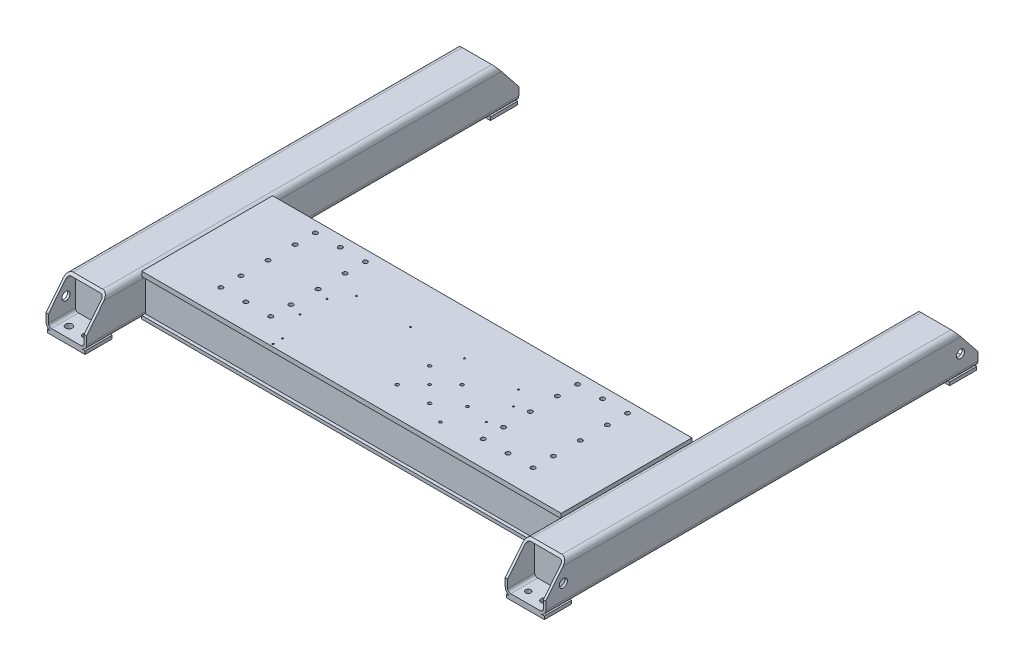
from build123d import *

# Parameters (mm, degrees)
EXTRUDE_1_DEPTH          = 800
EXTRUDE_1_DEPTH_BACK     = 800
EXTRUDE_1_2_DEPTH        = 800
EXTRUDE_1_2_DEPTH_BACK   = 800
CUT_EXTRUDE_1_DEPTH      = 1234.640547323
CUT_EXTRUDE_1_DEPTH_BACK = 1234.640547323
EXTRUDE_2_DEPTH          = 775
EXTRUDE_2_DEPTH_BACK     = 775
SKETCH_3_W               = 12
SKETCH_3_H               = 125
EXTRUDE_3_DEPTH          = 6
EXTRUDE_3_DEPTH_BACK     = 6
SKETCH_4_W               = 436
SKETCH_4_H               = 125
EXTRUDE_5_DEPTH          = 776.64969722
EXTRUDE_5_DEPTH_BACK     = 776.64969722
SKETCH_6_W               = 484
SKETCH_6_H               = 12
EXTRUDE_6_DEPTH          = 776.245006005
EXTRUDE_6_DEPTH_BACK     = 776.245006005
SKETCH_7_W               = 484
SKETCH_7_H               = 17
SKETCH_8_W               = 140
SKETCH_8_H               = 100
EXTRUDE_7_DEPTH          = 12
SKETCH_11_W              = 133
SKETCH_11_H              = 133
EXTRUDE_8_DEPTH          = 9
SKETCH_12_W              = 133
SKETCH_12_H              = 133
EXTRUDE_9_DEPTH          = 9
CUT_EXTRUDE_2_DEPTH      = 1235.1721922
CUT_EXTRUDE_2_DEPTH_BACK = 1235.1721922
CUT_EXTRUDE_3_DEPTH      = 1235.1721922
CUT_EXTRUDE_3_DEPTH_BACK = 1235.1721922
SKETCH_16_R              = 8
CUT_EXTRUDE_4_DEPTH      = 17
SKETCH_17_R              = 8
CUT_EXTRUDE_5_DEPTH      = 17
SKETCH_18_R              = 3
CUT_EXTRUDE_6_DEPTH      = 12
SKETCH_19_R              = 3
CUT_EXTRUDE_7_DEPTH      = 17
SKETCH_20_R              = 3
CUT_EXTRUDE_8_DEPTH      = 17
SKETCH_21_R              = 6
CUT_EXTRUDE_9_DEPTH      = 17
SKETCH_22_R              = 5
CUT_EXTRUDE_10_DEPTH     = 17
SKETCH_23_R              = 5
CUT_EXTRUDE_11_DEPTH     = 17
SKETCH_25_R              = 12.5
CUT_EXTRUDE_13_DEPTH     = 21
SKETCH_27_R              = 10
CUT_EXTRUDE_15_DEPTH     = 21
SKETCH_30_R              = 15
CUT_EXTRUDE_17_DEPTH     = 9
CUT_EXTRUDE_START        = -9
SKETCH_32_R              = 15
CUT_EXTRUDE_18_DEPTH     = 9


with BuildPart() as part:
    # ｽｹｯﾁ1 → ﾎﾞｽ - 押し出し1 (new, two sides: drawn at the far end of the back side and taken through both)
    with BuildSketch(Plane.XY.offset(-EXTRUDE_1_DEPTH_BACK)):
        with BuildLine():
            Line((-905, 12), (-795, 12))
            ThreePointArc((-795, 12), (-780.857864376, 17.857864376), (-775, 32))
            Line((-775, 32), (-775, 142))
            ThreePointArc((-775, 142), (-780.857864376, 156.142135624), (-795, 162))
            Line((-795, 162), (-905, 162))
            ThreePointArc((-905, 162), (-919.142135624, 156.142135624), (-925, 142))
            Line((-925, 142), (-925, 32))
            ThreePointArc((-925, 32), (-919.142135624, 17.857864376), (-905, 12))
        make_face()
    extrude(amount=EXTRUDE_1_DEPTH + EXTRUDE_1_DEPTH_BACK)


with BuildPart() as body_2:
    # ｽｹｯﾁ1 → Extrude 1 2 (new, two sides: drawn at the far end of the back side and taken through both)
    with BuildSketch(Plane.XY.offset(-EXTRUDE_1_2_DEPTH_BACK)):
        with BuildLine():
            Line((795, 12), (905, 12))
            ThreePointArc((905, 12), (919.142135624, 17.857864376), (925, 32))
            Line((925, 32), (925, 142))
            ThreePointArc((925, 142), (919.142135624, 156.142135624), (905, 162))
            Line((905, 162), (795, 162))
            ThreePointArc((795, 162), (780.857864376, 156.142135624), (775, 142))
            Line((775, 142), (775, 32))
            ThreePointArc((775, 32), (780.857864376, 17.857864376), (795, 12))
        make_face()
    extrude(amount=EXTRUDE_1_2_DEPTH + EXTRUDE_1_2_DEPTH_BACK)


with BuildPart() as cut_extrude_1_tool:
    # ｽｹｯﾁ2 → ｶｯﾄ - 押し出し1 (new, two sides: drawn at the far end of the back side and taken through both)
    with BuildSketch(Plane.XY.offset(-CUT_EXTRUDE_1_DEPTH_BACK)):
        with BuildLine():
            Line((-905, 21), (-795, 21))
            ThreePointArc((-795, 21), (-787.221825407, 24.221825407), (-784, 32))
            Line((-784, 32), (-784, 142))
            ThreePointArc((-784, 142), (-787.221825407, 149.778174593), (-795, 153))
            Line((-795, 153), (-905, 153))
            ThreePointArc((-905, 153), (-912.778174593, 149.778174593), (-916, 142))
            Line((-916, 142), (-916, 32))
            ThreePointArc((-916, 32), (-912.778174593, 24.221825407), (-905, 21))
        make_face()
        with BuildLine():
            Line((795, 21), (905, 21))
            ThreePointArc((905, 21), (912.778174593, 24.221825407), (916, 32))
            Line((916, 32), (916, 142))
            ThreePointArc((916, 142), (912.778174593, 149.778174593), (905, 153))
            Line((905, 153), (795, 153))
            ThreePointArc((795, 153), (787.221825407, 149.778174593), (784, 142))
            Line((784, 142), (784, 32))
            ThreePointArc((784, 32), (787.221825407, 24.221825407), (795, 21))
        make_face()
    extrude(amount=CUT_EXTRUDE_1_DEPTH + CUT_EXTRUDE_1_DEPTH_BACK)


with BuildPart() as part_1:
    add(part.part)

    # ｶｯﾄ - 押し出し1: cut by cut_extrude_1_tool
    add(cut_extrude_1_tool.part, mode=Mode.SUBTRACT)



with BuildPart() as body_2_1:
    add(body_2.part)

    # ｶｯﾄ - 押し出し1: cut by cut_extrude_1_tool
    add(cut_extrude_1_tool.part, mode=Mode.SUBTRACT)


with BuildPart() as part_2:
    add(part_1.part)

    add(body_2_1.part)  # ﾎﾞｽ - 押し出し2 merges body 2
    # ｽｹｯﾁ3 → ﾎﾞｽ - 押し出し2 (add, two sides: drawn at the far end of the back side and taken through both)
    with BuildSketch(Plane(origin=(0, 0, 0), x_dir=(0, 0, -1), z_dir=(1, 0, 0)).offset(-EXTRUDE_2_DEPTH_BACK)):
        with Locations((-576, 86.5)):
            Rectangle(SKETCH_3_W, SKETCH_3_H)
        with Locations((-128, 86.5)):
            Rectangle(SKETCH_3_W, SKETCH_3_H)
    extrude(amount=EXTRUDE_2_DEPTH + EXTRUDE_2_DEPTH_BACK)

    # ｽｹｯﾁ4 → ﾎﾞｽ - 押し出し3 (add, two sides: drawn at the far end of the back side and taken through both)
    with BuildSketch(Plane(origin=(0, 0, 0), x_dir=(0, 0, -1), z_dir=(1, 0, 0)).offset(-EXTRUDE_3_DEPTH_BACK)):
        with Locations((-352, 86.5)):
            Rectangle(SKETCH_4_W, SKETCH_4_H)
    extrude(amount=EXTRUDE_3_DEPTH + EXTRUDE_3_DEPTH_BACK)

    # ｽｹｯﾁ6 → ﾎﾞｽ - 押し出し5 (add, two sides: drawn at the far end of the back side and taken through both)
    with BuildSketch(Plane(origin=(0, 0, 0), x_dir=(0, 0, -1), z_dir=(1, 0, 0)).offset(-EXTRUDE_5_DEPTH_BACK)):
        with Locations((-352, 18)):
            Rectangle(SKETCH_6_W, SKETCH_6_H)
    extrude(amount=EXTRUDE_5_DEPTH + EXTRUDE_5_DEPTH_BACK)

    # ｽｹｯﾁ7 → ﾎﾞｽ - 押し出し6 (add, two sides: drawn at the far end of the back side and taken through both)
    with BuildSketch(Plane(origin=(0, 0, 0), x_dir=(0, 0, -1), z_dir=(1, 0, 0)).offset(-EXTRUDE_6_DEPTH_BACK)):
        with Locations((-352, 157.5)):
            Rectangle(SKETCH_7_W, SKETCH_7_H)
    extrude(amount=EXTRUDE_6_DEPTH + EXTRUDE_6_DEPTH_BACK)

    # ｽｹｯﾁ8 → ﾎﾞｽ - 押し出し7 (add)
    with BuildSketch(Plane(origin=(0, 0, 0), x_dir=(1, 0, 0), z_dir=(0, 1, 0))):
        with Locations((-850, -750)):
            Rectangle(SKETCH_8_W, SKETCH_8_H)
        with Locations((-850, 750)):
            Rectangle(SKETCH_8_W, SKETCH_8_H)
        with Locations((850, -750)):
            Rectangle(SKETCH_8_W, SKETCH_8_H)
        with Locations((850, 750)):
            Rectangle(SKETCH_8_W, SKETCH_8_H)
    extrude(amount=EXTRUDE_7_DEPTH)

    # ｽｹｯﾁ11 → ﾎﾞｽ - 押し出し8 (add)
    with BuildSketch(Plane.XY.offset(700)):
        with Locations((-850, 87)):
            Rectangle(SKETCH_11_W, SKETCH_11_H)
        with Locations((850, 87)):
            Rectangle(SKETCH_11_W, SKETCH_11_H)
    extrude(amount=-EXTRUDE_8_DEPTH)

    # ｽｹｯﾁ12 → ﾎﾞｽ - 押し出し9 (add)
    with BuildSketch(Plane.XY.offset(-700)):
        with Locations((-850, 87)):
            Rectangle(SKETCH_12_W, SKETCH_12_H)
        with Locations((850, 87)):
            Rectangle(SKETCH_12_W, SKETCH_12_H)
    extrude(amount=EXTRUDE_9_DEPTH)

    # ｽｹｯﾁ13 → ｶｯﾄ - 押し出し2 (cut, two sides: drawn at the far end of the back side and taken through both)
    with BuildSketch(Plane(origin=(0, 0, 0), x_dir=(0, 0, -1), z_dir=(1, 0, 0)).offset(-CUT_EXTRUDE_2_DEPTH_BACK)):
        Polygon((-850, -0.5), (-700, 187), (-700, 260), (-850, 260), align=None)
    extrude(amount=CUT_EXTRUDE_2_DEPTH + CUT_EXTRUDE_2_DEPTH_BACK, mode=Mode.SUBTRACT)

    # ｽｹｯﾁ14 → ｶｯﾄ - 押し出し3 (cut, two sides: drawn at the far end of the back side and taken through both)
    with BuildSketch(Plane(origin=(0, 0, 0), x_dir=(0, 0, -1), z_dir=(1, 0, 0)).offset(-CUT_EXTRUDE_3_DEPTH_BACK)):
        Polygon((850, -0.5), (700, 187), (700, 260), (850, 260), align=None)
    extrude(amount=CUT_EXTRUDE_3_DEPTH + CUT_EXTRUDE_3_DEPTH_BACK, mode=Mode.SUBTRACT)

    # ｽｹｯﾁ16 → ｶｯﾄ - 押し出し4 (cut)
    with BuildSketch(Plane(origin=(0, 166, 0), x_dir=(1, 0, 0), z_dir=(0, 1, 0))):
        with Locations((-578, -500)):
            Circle(SKETCH_16_R)
        with Locations((-485.5, -500)):
            Circle(SKETCH_16_R)
        with Locations((-393, -500)):
            Circle(SKETCH_16_R)
        with Locations((393, -500)):
            Circle(SKETCH_16_R)
        with Locations((485.5, -500)):
            Circle(SKETCH_16_R)
        with Locations((578, -500)):
            Circle(SKETCH_16_R)
        with Locations((-578, -425)):
            Circle(SKETCH_16_R)
        with Locations((-393, -425)):
            Circle(SKETCH_16_R)
        with Locations((393, -425)):
            Circle(SKETCH_16_R)
        with Locations((578, -425)):
            Circle(SKETCH_16_R)
        with Locations((-578, -225)):
            Circle(SKETCH_16_R)
        with Locations((-393, -225)):
            Circle(SKETCH_16_R)
        with Locations((393, -225)):
            Circle(SKETCH_16_R)
        with Locations((578, -225)):
            Circle(SKETCH_16_R)
        with Locations((-578, -150)):
            Circle(SKETCH_16_R)
        with Locations((-485.5, -150)):
            Circle(SKETCH_16_R)
        with Locations((-393, -150)):
            Circle(SKETCH_16_R)
        with Locations((393, -150)):
            Circle(SKETCH_16_R)
        with Locations((485.5, -150)):
            Circle(SKETCH_16_R)
        with Locations((578, -150)):
            Circle(SKETCH_16_R)
    extrude(amount=-CUT_EXTRUDE_4_DEPTH, mode=Mode.SUBTRACT)

    # ｽｹｯﾁ17 → ｶｯﾄ - 押し出し5 (cut)
    with BuildSketch(Plane(origin=(0, 166, 0), x_dir=(1, 0, 0), z_dir=(0, 1, 0))):
        with Locations((-578, -325)):
            Circle(SKETCH_17_R)
        with Locations((-393, -325)):
            Circle(SKETCH_17_R)
        with Locations((393, -325)):
            Circle(SKETCH_17_R)
        with Locations((578, -325)):
            Circle(SKETCH_17_R)
    extrude(amount=-CUT_EXTRUDE_5_DEPTH, mode=Mode.SUBTRACT)

    # ｽｹｯﾁ18 → ｶｯﾄ - 押し出し6 (cut)
    with BuildSketch(Plane(origin=(0, 166, 0), x_dir=(1, 0, 0), z_dir=(0, 1, 0))):
        with Locations((-300, -276)):
            Circle(SKETCH_18_R)
        with Locations((-100, -276)):
            Circle(SKETCH_18_R)
        with Locations((100, -276)):
            Circle(SKETCH_18_R)
        with Locations((300, -276)):
            Circle(SKETCH_18_R)
    extrude(amount=-CUT_EXTRUDE_6_DEPTH, mode=Mode.SUBTRACT)

    # ｽｹｯﾁ19 → ｶｯﾄ - 押し出し7 (cut)
    with BuildSketch(Plane(origin=(0, 166, 0), x_dir=(1, 0, 0), z_dir=(0, 1, 0))):
        with Locations((-345, -440)):
            Circle(SKETCH_19_R)
        with Locations((-345, -340)):
            Circle(SKETCH_19_R)
        with Locations((345, -440)):
            Circle(SKETCH_19_R)
        with Locations((345, -340)):
            Circle(SKETCH_19_R)
    extrude(amount=-CUT_EXTRUDE_7_DEPTH, mode=Mode.SUBTRACT)

    # ｽｹｯﾁ20 → ｶｯﾄ - 押し出し8 (cut)
    with BuildSketch(Plane(origin=(0, 166, 0), x_dir=(1, 0, 0), z_dir=(0, 1, 0))):
        with Locations((-300, -584)):
            Circle(SKETCH_20_R)
        with Locations((-300, -549)):
            Circle(SKETCH_20_R)
    extrude(amount=-CUT_EXTRUDE_8_DEPTH, mode=Mode.SUBTRACT)

    # ｽｹｯﾁ21 → ｶｯﾄ - 押し出し9 (cut)
    with BuildSketch(Plane(origin=(0, 166, 0), x_dir=(1, 0, 0), z_dir=(0, 1, 0))):
        with Locations((60, -485)):
            Circle(SKETCH_21_R)
        with Locations((180, -485)):
            Circle(SKETCH_21_R)
        with Locations((60, -365)):
            Circle(SKETCH_21_R)
        with Locations((180, -365)):
            Circle(SKETCH_21_R)
    extrude(amount=-CUT_EXTRUDE_9_DEPTH, mode=Mode.SUBTRACT)

    # ｽｹｯﾁ22 → ｶｯﾄ - 押し出し10 (cut)
    with BuildSketch(Plane(origin=(0, 166, 0), x_dir=(1, 0, 0), z_dir=(0, 1, 0))):
        with Locations((120, -425)):
            Circle(SKETCH_22_R)
    extrude(amount=-CUT_EXTRUDE_10_DEPTH, mode=Mode.SUBTRACT)

    # ｽｹｯﾁ23 → ｶｯﾄ - 押し出し11 (cut)
    with BuildSketch(Plane(origin=(0, 166, 0), x_dir=(1, 0, 0), z_dir=(0, 1, 0))):
        with Locations((260, -525)):
            Circle(SKETCH_23_R)
        with Locations((260, -425)):
            Circle(SKETCH_23_R)
    extrude(amount=-CUT_EXTRUDE_11_DEPTH, mode=Mode.SUBTRACT)

    # ｽｹｯﾁ25 → ｶｯﾄ - 押し出し13 (cut)
    with BuildSketch(Plane(origin=(0, 0, 0), x_dir=(1, 0, 0), z_dir=(0, 1, 0))):
        with Locations((-880, -760)):
            Circle(SKETCH_25_R)
        with Locations((-880, 760)):
            Circle(SKETCH_25_R)
        with Locations((880, -760)):
            Circle(SKETCH_25_R)
        with Locations((880, 760)):
            Circle(SKETCH_25_R)
    extrude(amount=CUT_EXTRUDE_13_DEPTH, mode=Mode.SUBTRACT)

    # ｽｹｯﾁ27 → ｶｯﾄ - 押し出し15 (cut)
    with BuildSketch(Plane(origin=(0, 0, 0), x_dir=(1, 0, 0), z_dir=(0, 1, 0))):
        with Locations((-820, -760)):
            Circle(SKETCH_27_R)
        with Locations((-820, 760)):
            Circle(SKETCH_27_R)
        with Locations((820, -760)):
            Circle(SKETCH_27_R)
        with Locations((820, 760)):
            Circle(SKETCH_27_R)
    extrude(amount=CUT_EXTRUDE_15_DEPTH, mode=Mode.SUBTRACT)

    # ｽｹｯﾁ30 → ｶｯﾄ - 押し出し17 (cut)
    with BuildSketch(Plane(origin=(-925, 0, 0), x_dir=(0, 0, -1), z_dir=(1, 0, 0))):
        with Locations((-735, 87)):
            Circle(SKETCH_30_R)
        with Locations((735, 87)):
            Circle(SKETCH_30_R)
    extrude(amount=CUT_EXTRUDE_17_DEPTH, mode=Mode.SUBTRACT)

    # ｽｹｯﾁ32 → ｶｯﾄ - 押し出し18 (cut)
    with BuildSketch(Plane(origin=(925, 0, 0), x_dir=(0, 0, -1), z_dir=(1, 0, 0)).offset(CUT_EXTRUDE_START)):
        with Locations((-735, 87)):
            Circle(SKETCH_32_R)
        with Locations((735, 87)):
            Circle(SKETCH_32_R)
    extrude(amount=CUT_EXTRUDE_18_DEPTH, mode=Mode.SUBTRACT)


solid = part_2.part
